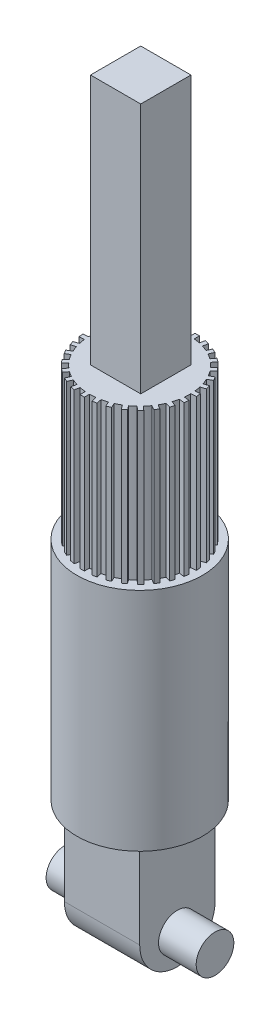
from build123d import *

# Parameters (mm, degrees)
SKETCH1_R                = 2
BOSS_EXTRUDE1_DEPTH      = 6
BOSS_EXTRUDE3_DEPTH      = 6
CIRPATTERN1_COUNT        = 30
SKETCH9_R                = 2.5
BOSS_EXTRUDE5_DEPTH      = 9
SKETCH10_W               = 2
SKETCH10_H               = 2
BOSS_EXTRUDE6_DEPTH      = 10
SKETCH11_W               = 3
SKETCH11_H               = 3
BOSS_EXTRUDE7_DEPTH      = 5
FILLET1_RADIUS           = 1.5
FILLET1_LENGTH           = 3
BOSS_EXTRUDE9_DEPTH      = 1.5
BOSS_EXTRUDE9_DEPTH_BACK = 4.477112072
SKETCH12_R               = 0.75


with BuildPart() as part:
    # Sketch1 → Boss-Extrude1 (new body)
    with BuildSketch(Plane(origin=(0, 0, 0), x_dir=(1, 0, 0), z_dir=(0, 1, 0))):
        with Locations(Location((0, 0, 0), (0, 0, 270))):
            Circle(SKETCH1_R)
    extrude(amount=BOSS_EXTRUDE1_DEPTH)

    # Sketch5 → Boss-Extrude3 (add)
    with BuildSketch(Plane(origin=(0, 6, 0), x_dir=(1, 0, 0), z_dir=(0, 1, 0))):
        Polygon((0, -2), (-0.176506233, -1.992196162), (-0.176506233, -2.202534122), (0, -2.202534122), align=None)
    boss_extrude3 = extrude(amount=-BOSS_EXTRUDE3_DEPTH)

    # CirPattern1: Boss-Extrude3 ×30 about axis
    cirpattern1_axis = Axis((0, 0, 0), (0, 1, 0))
    for i in range(1, CIRPATTERN1_COUNT):
        add(boss_extrude3.rotate(cirpattern1_axis, i * 360 / CIRPATTERN1_COUNT))

    # Sketch9 → Boss-Extrude5 (add)
    with BuildSketch(Plane.XZ):
        with Locations(Location((0, 0, 0), (0, 0, 270))):
            Circle(SKETCH9_R)
    extrude(amount=BOSS_EXTRUDE5_DEPTH)

    # Sketch10 → Boss-Extrude6 (add)
    with BuildSketch(Plane(origin=(0, 6, 0), x_dir=(1, 0, 0), z_dir=(0, 1, 0))):
        with Locations((0.009702593, 0.031661031)):
            Rectangle(SKETCH10_W, SKETCH10_H)
    extrude(amount=BOSS_EXTRUDE6_DEPTH)

    # Sketch11 → Boss-Extrude7 (add)
    with BuildSketch(Plane.XZ.offset(9)):
        Rectangle(SKETCH11_W, SKETCH11_H)
    extrude(amount=BOSS_EXTRUDE7_DEPTH)

    # Fillet1: full round fillet: the end face becomes a half cylinder, R = half its width
    fillet1_face = Plane((0, -14, 0), x_dir=(1, 0, 0), z_dir=(0, -1, 0))  # on the end face: x along it, z out of the body
    fillet1_slab = fillet1_face.offset(-FILLET1_RADIUS / 2) * Box(FILLET1_LENGTH, 2 * FILLET1_RADIUS, FILLET1_RADIUS, mode=Mode.PRIVATE)  # the body's end, R deep
    fillet1_round = Plane((0, -12.5, 0), x_dir=(0, -1, 0), z_dir=(1, 0, 0)) * Cylinder(FILLET1_RADIUS, FILLET1_LENGTH, mode=Mode.PRIVATE)  # its axis R under the face
    add(fillet1_slab - fillet1_round, mode=Mode.SUBTRACT)

    # Sketch12 → Boss-Extrude9 (add, two sides: drawn at the far end of the back side and taken through both)
    with BuildSketch(Plane(origin=(1.5, 0, 0), x_dir=(0, 0, -1), z_dir=(1, 0, 0)).offset(-BOSS_EXTRUDE9_DEPTH_BACK)):
        with Locations((0, -12.8)):
            Circle(SKETCH12_R)
    extrude(amount=BOSS_EXTRUDE9_DEPTH + BOSS_EXTRUDE9_DEPTH_BACK)


solid = part.part
